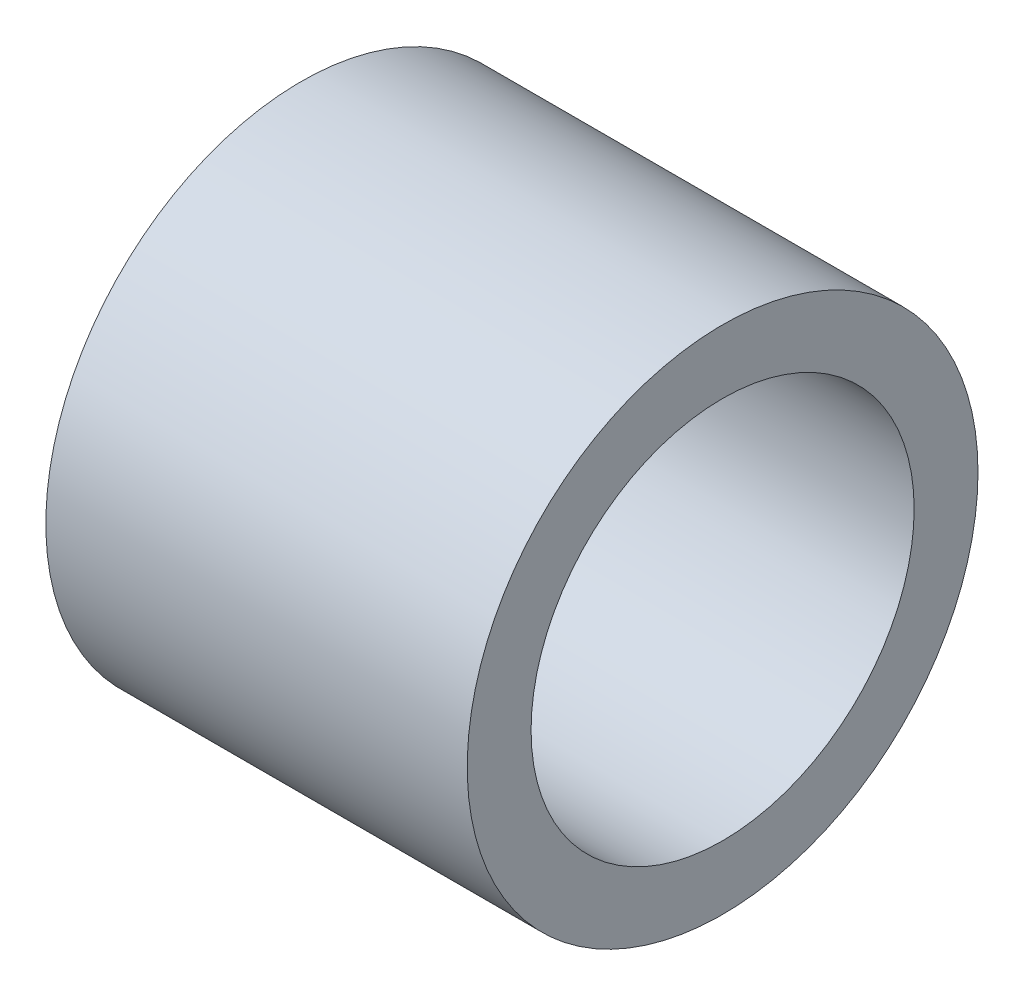
from build123d import *

# Parameters (mm, degrees)
SKETCH2_R           = 10
SKETCH2_R_2         = 7.5
BOSS_EXTRUDE1_DEPTH = 8.25


with BuildPart() as part:
    # Sketch2 → Boss-Extrude1 (new, symmetric)
    with BuildSketch(Plane(origin=(0, 0, 0), x_dir=(0, 0, -1), z_dir=(1, 0, 0))):
        Circle(SKETCH2_R)
        Circle(SKETCH2_R_2, mode=Mode.SUBTRACT)
    extrude(amount=BOSS_EXTRUDE1_DEPTH, both=True)


solid = part.part
